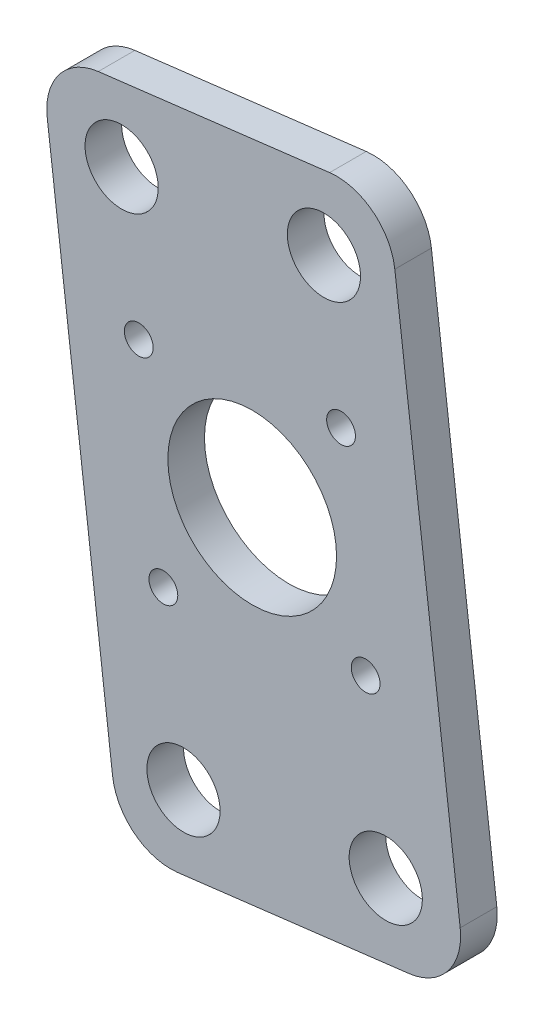
from build123d import *

# Parameters (mm, degrees)
SKETCH1_R           = 7.317167392
SKETCH1_R_2         = 3.175
BOSS_EXTRUDE2_DEPTH = 3.175


with BuildPart() as part:
    # Sketch1 → Boss-Extrude2 (new body)
    with BuildSketch(Plane.XY):
        with BuildLine():
            ThreePointArc((-108.18478159, -135.764097779), (-107.141377815, -132.018654189), (-103.75515137, -130.108023512))
            Line((-103.75515137, -130.108023512), (-83.685324569, -127.667488038))
            ThreePointArc((-83.685324569, -127.667488038), (-79.939880979, -128.710891812), (-78.029250302, -132.097118258))
            Line((-78.029250302, -132.097118258), (-72.356946589, -178.743501511))
            ThreePointArc((-72.356946589, -178.743501511), (-73.400350364, -182.488945101), (-76.78657681, -184.399575778))
            Line((-76.78657681, -184.399575778), (-96.85640361, -186.840111252))
            ThreePointArc((-96.85640361, -186.840111252), (-100.6018472, -185.796707477), (-102.512477877, -182.410481032))
            Line((-102.512477877, -182.410481032), (-108.18478159, -135.764097779))
        make_face()
        with Locations((-90.400440681, -156.188222118)):
            Circle(SKETCH1_R, mode=Mode.SUBTRACT)
        with Locations((-96.362218078, -180.383240442)):
            Circle(SKETCH1_R_2, mode=Mode.SUBTRACT)
        with Locations((-78.813817399, -178.249315979)):
            Circle(SKETCH1_R_2, mode=Mode.SUBTRACT)
        with Locations((-84.179510101, -134.124358848)):
            Circle(SKETCH1_R_2, mode=Mode.SUBTRACT)
        with Locations((-101.72791078, -136.258283311)):
            Circle(SKETCH1_R_2, mode=Mode.SUBTRACT)
        with BuildLine():
            ThreePointArc((-99.257486995, -149.251707821), (-99.470879442, -147.496867753), (-101.225719509, -147.710260199))
            ThreePointArc((-101.225719509, -147.710260199), (-101.012327063, -149.465100267), (-99.257486995, -149.251707821))
        make_face(mode=Mode.SUBTRACT)
        with BuildLine():
            ThreePointArc((-83.677318831, -145.576335736), (-83.463926384, -147.331175804), (-81.709086316, -147.117783358))
            ThreePointArc((-81.709086316, -147.117783358), (-81.922478763, -145.36294329), (-83.677318831, -145.576335736))
        make_face(mode=Mode.SUBTRACT)
        with BuildLine():
            ThreePointArc((-79.575161853, -164.666184037), (-79.7885543, -162.911343969), (-81.543394368, -163.124736415))
            ThreePointArc((-81.543394368, -163.124736415), (-81.330001921, -164.879576483), (-79.575161853, -164.666184037))
        make_face(mode=Mode.SUBTRACT)
        with BuildLine():
            ThreePointArc((-99.091795046, -165.258660878), (-98.8784026, -167.013500946), (-97.123562532, -166.8001085))
            ThreePointArc((-97.123562532, -166.8001085), (-97.336954979, -165.045268432), (-99.091795046, -165.258660878))
        make_face(mode=Mode.SUBTRACT)
    extrude(amount=BOSS_EXTRUDE2_DEPTH)


solid = part.part
